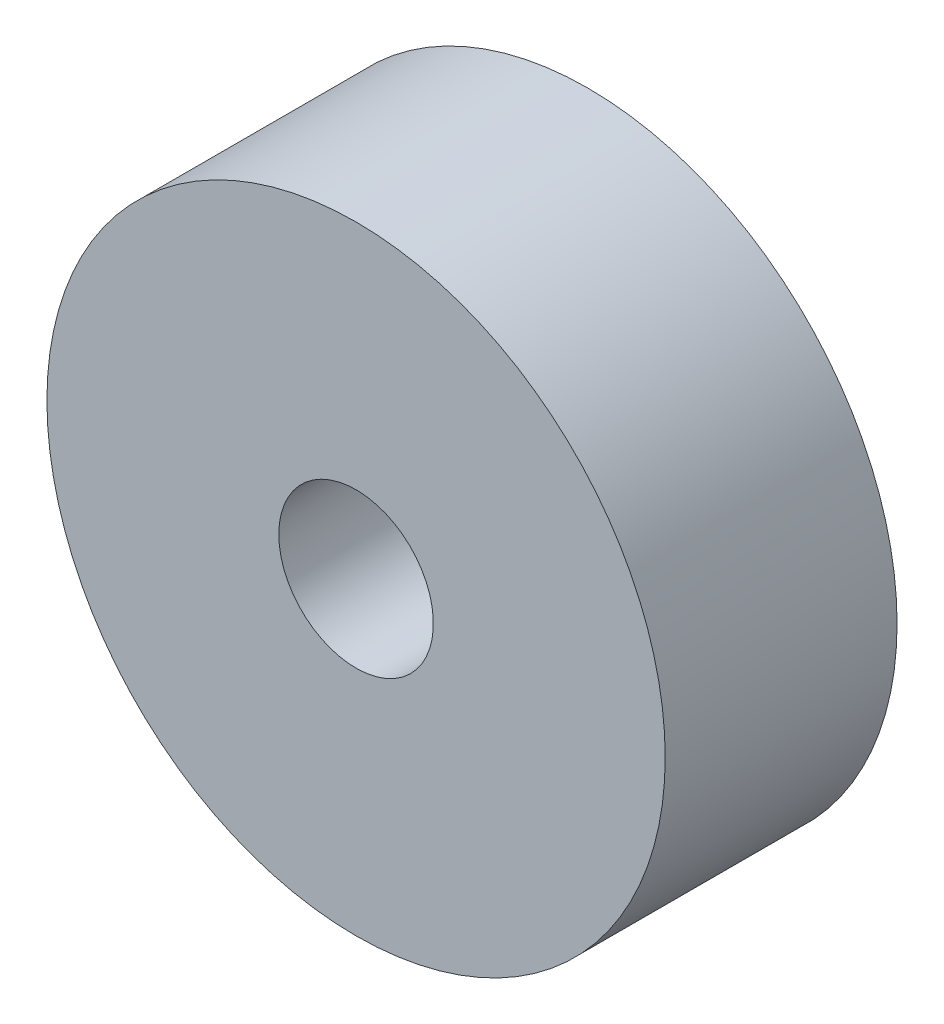
from build123d import *

# Parameters (mm, degrees)
SKETCH1_R           = 50.8
SKETCH1_R_2         = 12.7
BOSS_EXTRUDE1_DEPTH = 38.1


with BuildPart() as part:
    # Sketch1 → Boss-Extrude1 (new body)
    with BuildSketch(Plane.XY):
        with Locations(Location((0, 0, 0), (0, 0, 180))):
            Circle(SKETCH1_R)
        with Locations(Location((0, 0, 0), (0, 0, 180))):
            Circle(SKETCH1_R_2, mode=Mode.SUBTRACT)
    extrude(amount=BOSS_EXTRUDE1_DEPTH)


solid = part.part
